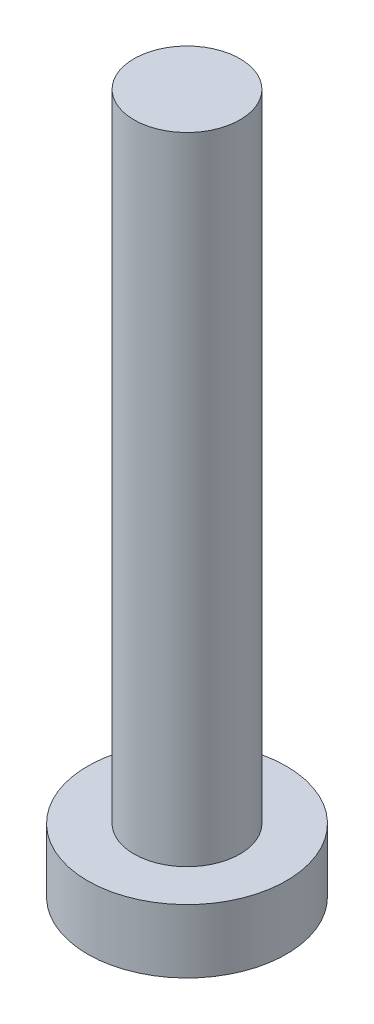
from build123d import *

# Parameters (mm, degrees)
SKETCH1_R           = 1.875
BOSS_EXTRUDE1_DEPTH = 1.2
SKETCH2_R           = 1
BOSS_EXTRUDE2_DEPTH = 12


with BuildPart() as part:
    # Sketch1 → Boss-Extrude1 (new body)
    with BuildSketch(Plane(origin=(0, 0, 0), x_dir=(1, 0, 0), z_dir=(0, 1, 0))):
        with Locations(Location((0, 0, 0), (0, 0, 270))):
            Circle(SKETCH1_R)
        Polygon((0.866025404, 0), (0.433012702, 0.75), (-0.433012702, 0.75), (-0.866025404, 0), (-0.433012702, -0.75), (0.433012702, -0.75), align=None, mode=Mode.SUBTRACT)
    extrude(amount=BOSS_EXTRUDE1_DEPTH)

    # Sketch2 → Boss-Extrude2 (add)
    with BuildSketch(Plane(origin=(0, 1.2, 0), x_dir=(1, 0, 0), z_dir=(0, 1, 0))):
        with Locations(Location((0, 0, 0), (0, 0, 270))):
            Circle(SKETCH2_R)
    extrude(amount=BOSS_EXTRUDE2_DEPTH)


solid = part.part
